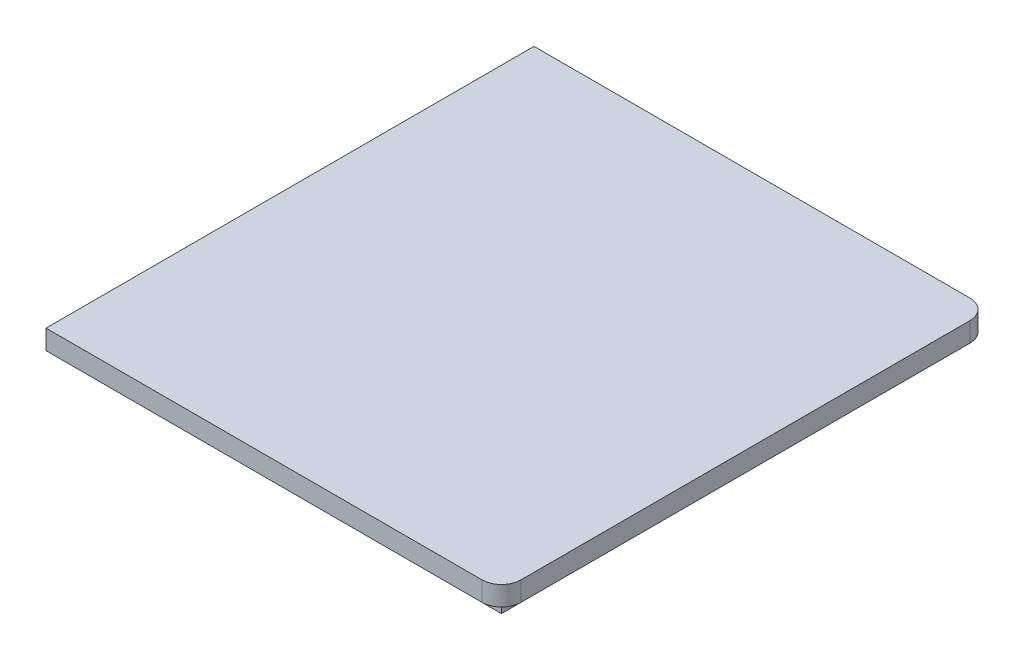
from build123d import *

# Parameters (mm, degrees)
SKETCH1_W           = 70
SKETCH1_H           = 75
BOSS_EXTRUDE1_DEPTH = 3
SKETCH2_W           = 64
SKETCH2_H           = 69
BOSS_EXTRUDE2_DEPTH = 3
FILLET1_R           = 3


with BuildPart() as part:
    # Sketch1 → Boss-Extrude1 (new body)
    with BuildSketch(Plane(origin=(0, 0, 0), x_dir=(1, 0, 0), z_dir=(0, 1, 0))):
        Rectangle(SKETCH1_W, SKETCH1_H)
    extrude(amount=BOSS_EXTRUDE1_DEPTH)

    # Sketch2 → Boss-Extrude2 (add)
    with BuildSketch(Plane.XZ):
        Rectangle(SKETCH2_W, SKETCH2_H)
    extrude(amount=BOSS_EXTRUDE2_DEPTH)

    # Fillet1
    fillet1_edges = [part.edges().sort_by_distance(p)[0] for p in [
        (35, 1.5, 37.5),
        (35, 1.5, -37.5),
    ]]
    fillet(fillet1_edges, radius=FILLET1_R)


solid = part.part
